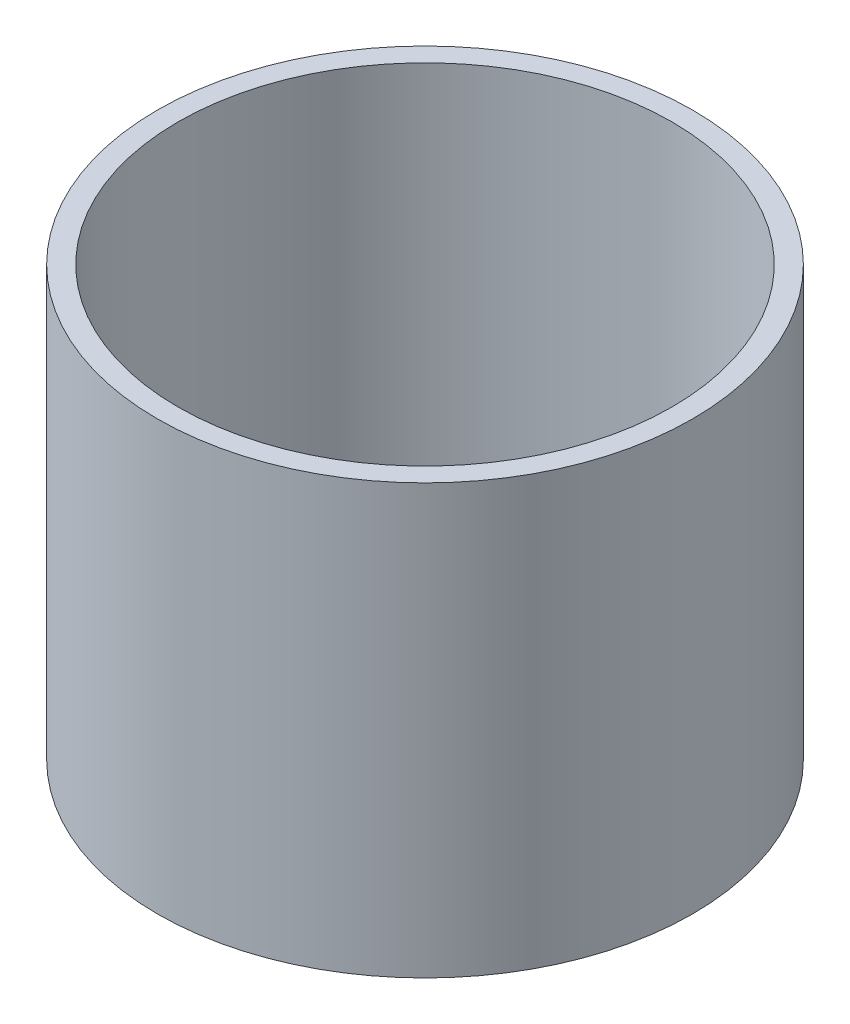
from build123d import *

# Parameters (mm, degrees)
SKETCH1_R           = 15.6
BOSS_EXTRUDE1_DEPTH = 3
SKETCH2_R           = 4.275
CUT_EXTRUDE1_DEPTH  = 1.5
BOSS_EXTRUDE2_START = 22
SKETCH3_R           = 15.6
SKETCH3_R_2         = 14.4
BOSS_EXTRUDE2_DEPTH = 22
SKETCH4_R           = 1
CUT_EXTRUDE3_DEPTH  = 3


with BuildPart() as part:
    # Sketch1 → Boss-Extrude1 (new body)
    with BuildSketch(Plane(origin=(0, 0, 0), x_dir=(1, 0, 0), z_dir=(0, 1, 0))):
        with Locations(Location((0, 0, 0), (0, 0, 270))):
            Circle(SKETCH1_R)
    extrude(amount=-BOSS_EXTRUDE1_DEPTH)

    # Sketch2 → Cut-Extrude1 (cut)
    with BuildSketch(Plane(origin=(0, 0, 0), x_dir=(1, 0, 0), z_dir=(0, 1, 0))):
        with Locations(Location((0, 0, 0), (0, 0, 270))):
            Circle(SKETCH2_R)
    extrude(amount=-CUT_EXTRUDE1_DEPTH, mode=Mode.SUBTRACT)

    # Sketch3 → Boss-Extrude2 (add)
    with BuildSketch(Plane(origin=(0, 0, 0), x_dir=(1, 0, 0), z_dir=(0, 1, 0)).offset(BOSS_EXTRUDE2_START)):
        with Locations(Location((0, 0, 0), (0, 0, 270))):
            Circle(SKETCH3_R)
        with Locations(Location((0, 0, 0), (0, 0, 270))):
            Circle(SKETCH3_R_2, mode=Mode.SUBTRACT)
    extrude(amount=-BOSS_EXTRUDE2_DEPTH)

    # Sketch4 → Cut-Extrude3 (cut)
    with BuildSketch(Plane(origin=(0, -3, 0), x_dir=(-1, 0, 0), z_dir=(0, -1, 0))):
        with Locations(Location((-5.991069688, 0.327236899, 0), (0, 0, 90))):
            Circle(SKETCH4_R)
        with Locations(Location((3.278930312, 5.024800097, 0), (0, 0, 270))):
            Circle(SKETCH4_R)
        with Locations(Location((2.712139377, -5.352036995, 0), (0, 0, 270))):
            Circle(SKETCH4_R)
    extrude(amount=-CUT_EXTRUDE3_DEPTH, mode=Mode.SUBTRACT)


solid = part.part
